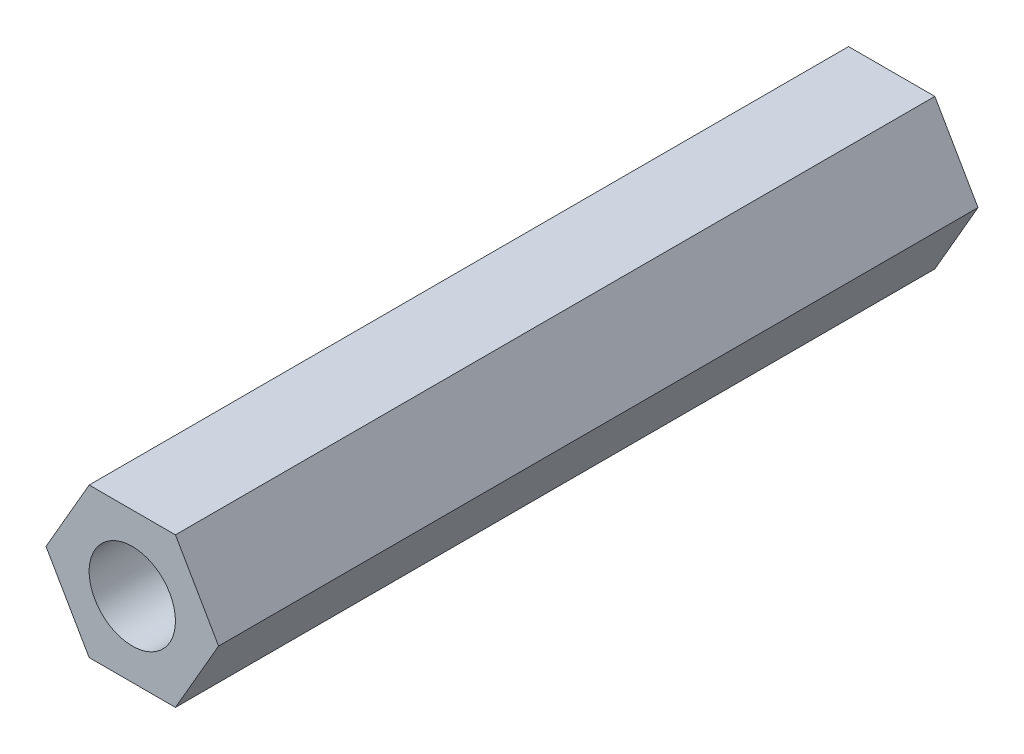
from build123d import *

# Parameters (mm, degrees)
EXTRUDE_1_DEPTH    = 22
HOLE_WIZARD_M3_1_D = 2.5


with BuildPart() as part:
    # 草图1 → 凸台-拉伸1 (new body)
    with BuildSketch(Plane.XY):
        Polygon((0, 0), (2.5, 0), (3.75, -2.165063509), (2.5, -4.330127019), (0, -4.330127019), (-1.25, -2.165063509), align=None)
    extrude(amount=EXTRUDE_1_DEPTH)

    # M3 螺纹孔1 (through all)
    with Locations(Plane.XY.offset(22)):
        with Locations((1.25, -2.165063509)):
            Hole(HOLE_WIZARD_M3_1_D / 2)


solid = part.part
